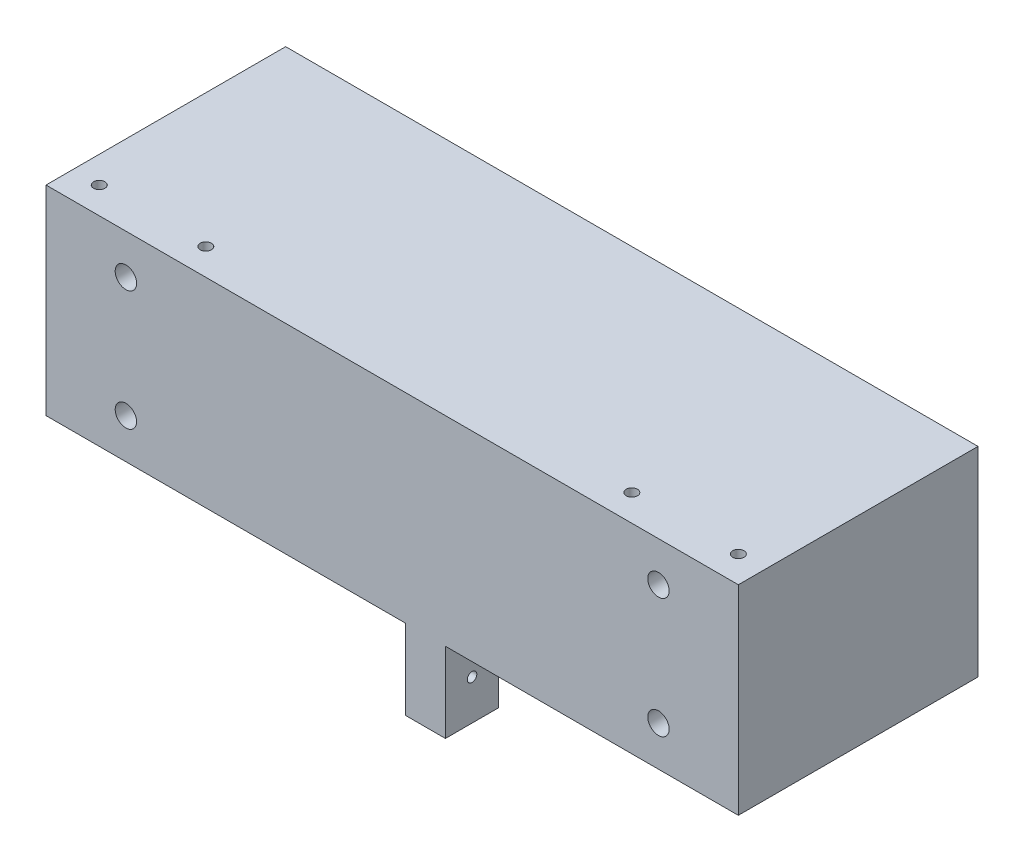
from build123d import *

# Parameters (mm, degrees)
SKETCH1_W               = 165.1
SKETCH1_H               = 57.15
BOSS_EXTRUDE1_DEPTH     = 47.625
SKETCH6_W               = 9.525
SKETCH6_H               = 19.05
BOSS_EXTRUDE2_DEPTH     = 12.7
F_4_40_TAPPED_HOLE1_D   = 2.2606
F_1_4_20_TAPPED_HOLE1_D = 5.1054
F_6_32_TAPPED_HOLE1_D   = 2.7051


with BuildPart() as part:
    # Sketch1 → Boss-Extrude1 (new body)
    with BuildSketch(Plane(origin=(0, 0, 0), x_dir=(1, 0, 0), z_dir=(0, 1, 0))):
        Rectangle(SKETCH1_W, SKETCH1_H)
    extrude(amount=BOSS_EXTRUDE1_DEPTH)

    # Sketch6 → Boss-Extrude2 (add)
    with BuildSketch(Plane.XY.offset(28.575)):
        with Locations((7.9375, -9.525)):
            Rectangle(SKETCH6_W, SKETCH6_H)
    extrude(amount=-BOSS_EXTRUDE2_DEPTH)

    # #4-40 Tapped Hole1 (through all)
    with Locations(Plane(origin=(12.7, 0, 0), x_dir=(0, 0, -1), z_dir=(1, 0, 0))):
        with Locations((-22.225, -9.525)):
            Hole(F_4_40_TAPPED_HOLE1_D / 2)

    # 1/4-20 Tapped Hole1 (through all)
    with Locations(Plane.XY.offset(28.575)):
        with Locations((-63.5, 38.1), (-63.5, 9.525), (63.5, 38.1), (63.5, 9.525)):
            Hole(F_1_4_20_TAPPED_HOLE1_D / 2)

    # #6-32 Tapped Hole1 (through all)
    with Locations(Plane(origin=(0, 47.625, 0), x_dir=(1, 0, 0), z_dir=(0, 1, 0))):
        with Locations((-76.2, -22.225), (-50.8, -22.225), (50.8, -22.225), (76.2, -22.225)):
            Hole(F_6_32_TAPPED_HOLE1_D / 2)


solid = part.part
